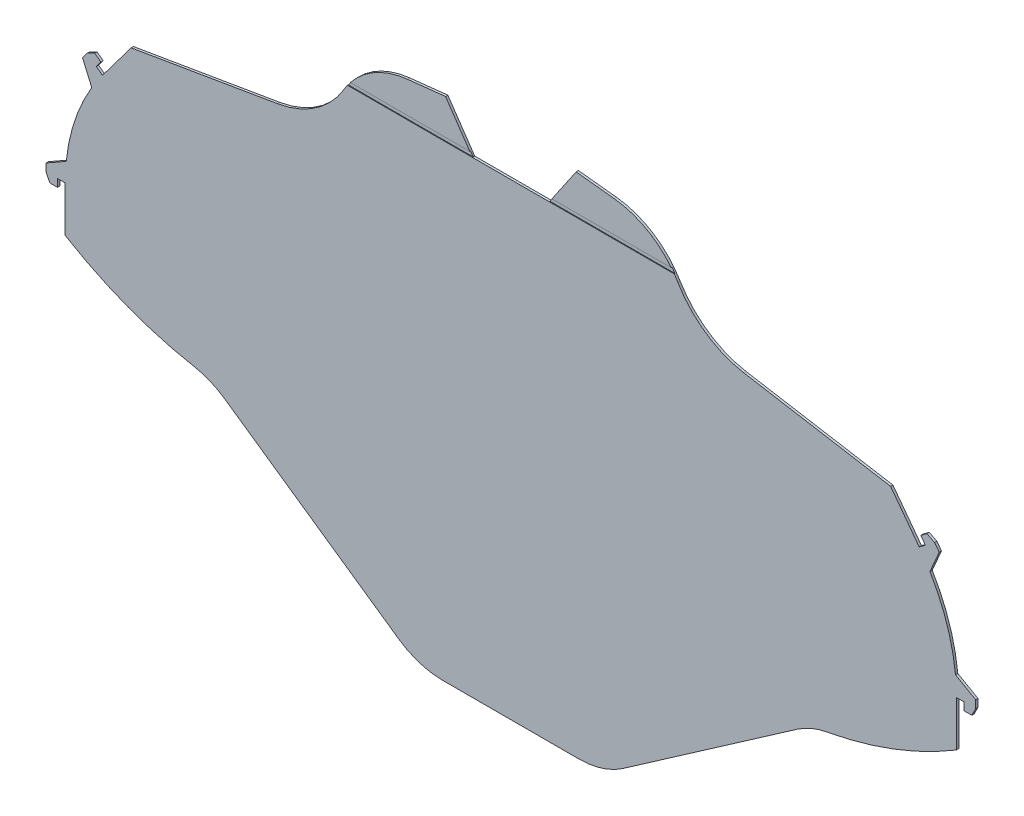
from build123d import *

# Parameters (mm, degrees)
MAIN_SHAPE_DEPTH    = 0.6
TABS_DEPTH          = 154.060061459
TABS_DEPTH_BACK     = 154.060061459
SKETCH4_W           = 90
SKETCH4_H           = 1
TAB_FOLD_LINE_DEPTH = 0.2
CHIN_GUARD_DEPTH    = 0.6
FILLET1_R           = 20


with BuildPart() as part:
    # Sketch1 → Main Shape (new body)
    with BuildSketch(Plane.XY):
        with BuildLine():
            Line((-24, -91.764766734), (24, -91.764766734))
            Line((24, -91.764766734), (78.266232563, -84.05670244))
            ThreePointArc((78.266232563, -84.05670244), (97.655491519, -79.289252293), (115.711102551, -70.764766734))
            ThreePointArc((115.711102551, -70.764766734), (120.685143325, -65.658407438), (122.5, -58.764766734))
            ThreePointArc((122.5, -58.764766734), (120.227482046, -43.118277124), (113.597722286, -28.764766734))
            ThreePointArc((113.597722286, -28.764766734), (107.811505455, -22.955172168), (100.180351554, -19.955641477))
            Line((100.180351554, -19.955641477), (60.74391922, -13.264766734))
            ThreePointArc((60.74391922, -13.264766734), (50.804108255, -9.246591688), (43.461443341, -1.434367632))
            ThreePointArc((43.461443341, -1.434367632), (36.448172688, 5.805997675), (26.941855461, 9.15842781))
            Line((26.941855461, 9.15842781), (17, 10.235233266))
            Line((17, 10.235233266), (10, 0))
            Line((10, 0), (-10, 0))
            Line((-10, 0), (-17, 10.235233266))
            Line((-17, 10.235233266), (-26.941855461, 9.15842781))
            ThreePointArc((-26.941855461, 9.15842781), (-36.448172688, 5.805997675), (-43.461443341, -1.434367632))
            ThreePointArc((-43.461443341, -1.434367632), (-50.804108255, -9.246591688), (-60.74391922, -13.264766734))
            Line((-60.74391922, -13.264766734), (-100.180351554, -19.955641477))
            ThreePointArc((-100.180351554, -19.955641477), (-107.811505455, -22.955172168), (-113.597722286, -28.764766734))
            ThreePointArc((-113.597722286, -28.764766734), (-120.227482046, -43.118277124), (-122.5, -58.764766734))
            ThreePointArc((-122.5, -58.764766734), (-120.685143325, -65.658407438), (-115.711102551, -70.764766734))
            ThreePointArc((-115.711102551, -70.764766734), (-97.655491519, -79.289252293), (-78.266232563, -84.05670244))
            Line((-78.266232563, -84.05670244), (-24, -91.764766734))
        make_face()
    extrude(amount=MAIN_SHAPE_DEPTH)

    # Sketch2 → Tabs (cut, two sides: drawn at the far end of the back side and taken through both)
    with BuildSketch(Plane.XY.offset(0.6).offset(-TABS_DEPTH_BACK)):
        with BuildLine():
            Line((-121, -58.764766734), (-121, -56.764766734))
            Line((-121, -56.764766734), (-115.742268041, -53.771413729))
            ThreePointArc((-115.742268041, -53.771413729), (-113.511139955, -43.427720083), (-109.089826236, -33.814088314))
            Line((-109.089826236, -33.814088314), (-111.5, -28.264766734))
            Line((-111.5, -28.264766734), (-110.3, -26.664766734))
            Line((-110.3, -26.664766734), (-108.3, -25.664766734))
            Line((-108.3, -25.664766734), (-106.7, -26.864766734))
            Line((-106.7, -26.864766734), (-107.9, -28.464766734))
            Line((-107.9, -28.464766734), (-106.3, -29.664766734))
            Line((-106.3, -29.664766734), (-98.84870892, -19.729711961))
            Line((-98.84870892, -19.729711961), (-100.180351554, -19.955641477))
            ThreePointArc((-100.180351554, -19.955641477), (-107.811505455, -22.955172168), (-113.597722286, -28.764766734))
            ThreePointArc((-113.597722286, -28.764766734), (-120.227482046, -43.118277124), (-122.5, -58.764766734))
            ThreePointArc((-122.5, -58.764766734), (-120.767844146, -65.510135516), (-116, -70.586357152))
            Line((-116, -70.586357152), (-116, -58.764766734))
            Line((-116, -58.764766734), (-118, -58.764766734))
            Line((-118, -58.764766734), (-118, -60.764766734))
            Line((-118, -60.764766734), (-120, -60.764766734))
            Line((-120, -60.764766734), (-121, -58.764766734))
        make_face()
        with BuildLine():
            Line((110.3, -26.664766734), (111.5, -28.264766734))
            Line((111.5, -28.264766734), (109.089826236, -33.814088314))
            ThreePointArc((109.089826236, -33.814088314), (113.511139955, -43.427720083), (115.742268041, -53.771413729))
            Line((115.742268041, -53.771413729), (121, -56.764766734))
            Line((121, -56.764766734), (121, -58.764766734))
            Line((121, -58.764766734), (120, -60.764766734))
            Line((120, -60.764766734), (118, -60.764766734))
            Line((118, -60.764766734), (118, -58.764766734))
            Line((118, -58.764766734), (116, -58.764766734))
            Line((116, -58.764766734), (116, -70.586357152))
            ThreePointArc((116, -70.586357152), (120.767844146, -65.510135516), (122.5, -58.764766734))
            ThreePointArc((122.5, -58.764766734), (120.227482046, -43.118277124), (113.597722286, -28.764766734))
            ThreePointArc((113.597722286, -28.764766734), (107.811505455, -22.955172168), (100.180351554, -19.955641477))
            Line((100.180351554, -19.955641477), (98.84870892, -19.729711961))
            Line((98.84870892, -19.729711961), (106.3, -29.664766734))
            Line((106.3, -29.664766734), (107.9, -28.464766734))
            Line((107.9, -28.464766734), (106.7, -26.864766734))
            Line((106.7, -26.864766734), (108.3, -25.664766734))
            Line((108.3, -25.664766734), (110.3, -26.664766734))
        make_face()
    extrude(amount=TABS_DEPTH + TABS_DEPTH_BACK, mode=Mode.SUBTRACT)

    # Sketch4 → Tab Fold Line (cut)
    with BuildSketch(Plane.XY.offset(0.6)):
        with Locations((0, 0.5)):
            Rectangle(SKETCH4_W, SKETCH4_H)
    extrude(amount=-TAB_FOLD_LINE_DEPTH, mode=Mode.SUBTRACT)

    # Sketch5 → Chin guard (add)
    with BuildSketch(Plane.XY.offset(0.6)):
        Polygon((-78.266232563, -84.05670244), (-24, -121.764766734), (24, -121.764766734), (78.266232563, -84.05670244), (24, -91.764766734), (-24, -91.764766734), align=None)
    extrude(amount=-CHIN_GUARD_DEPTH)

    # Fillet1
    fillet1_edges = [part.edges().sort_by_distance(p)[0] for p in [
        (-24, -121.764766734, 0.3),
        (24, -121.764766734, 0.3),
        (78.266232563, -84.05670244, 0.3),
        (-78.266232563, -84.05670244, 0.3),
    ]]
    fillet(fillet1_edges, radius=FILLET1_R)


solid = part.part
